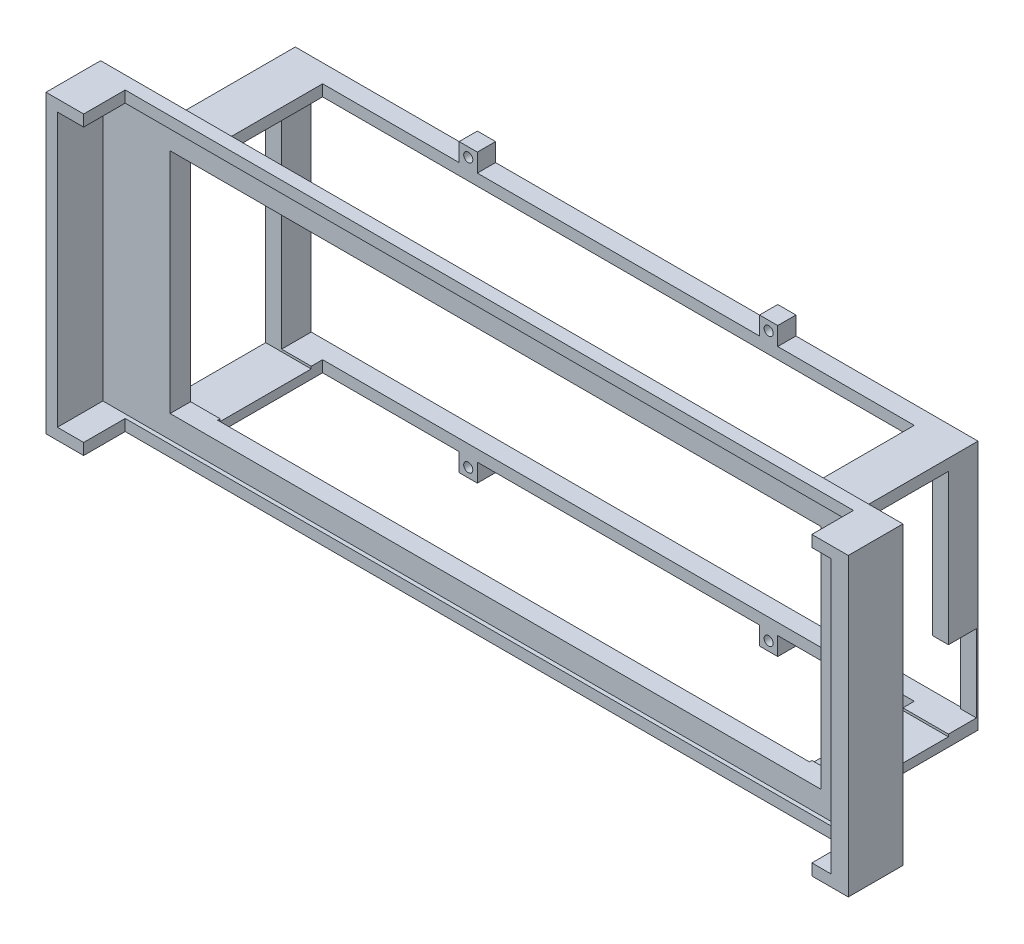
from build123d import *

# Parameters (mm, degrees)
SKETCH1_W               = 150
SKETCH1_H               = 55
SKETCH1_W_2             = 143
SKETCH1_H_2             = 50
BOSS_EXTRUDE1_DEPTH     = 30
CUT_EXTRUDE6_DEPTH      = 46
CUT_EXTRUDE6_DEPTH_BACK = 1
SKETCH2_W               = 170
SKETCH2_H               = 60
SKETCH3_W               = 176.272583165
SKETCH3_H               = 65
BOSS_EXTRUDE3_DEPTH     = 12
SKETCH4_W               = 170
SKETCH4_H               = 60
CUT_EXTRUDE7_DEPTH      = 10
CUT_EXTRUDE8_DEPTH      = 102.484371807
CUT_EXTRUDE8_DEPTH_BACK = 102.484371807
SKETCH5_W               = 143
SKETCH5_H               = 50
SKETCH6_W               = 4
SKETCH6_H               = 4
BOSS_EXTRUDE5_DEPTH     = 4
CUT_EXTRUDE9_DEPTH      = 105.971794883
CUT_EXTRUDE9_DEPTH_BACK = 4
SKETCH7_R               = 1
SKETCH8_W               = 28
SKETCH8_H               = 17
CUT_EXTRUDE12_DEPTH     = 10
SKETCH9_W               = 130
SKETCH9_H               = 23.050427834
CUT_EXTRUDE13_DEPTH     = 72
SKETCH10_W              = 20
SKETCH10_H              = 50.513415504
CUT_EXTRUDE14_DEPTH     = 177
SKETCH11_W              = 160
SKETCH11_H              = 10.657938717
CUT_EXTRUDE15_DEPTH     = 177


with BuildPart() as part:
    # Sketch1 → Boss-Extrude1 (new body)
    with BuildSketch(Plane.XY):
        with Locations((1.175180371, 5.902996071)):
            Rectangle(SKETCH1_W, SKETCH1_H)
        with Locations((1.175180371, 5.902996071)):
            Rectangle(SKETCH1_W_2, SKETCH1_H_2, mode=Mode.SUBTRACT)
    extrude(amount=BOSS_EXTRUDE1_DEPTH)

    # Sketch2 → Cut-Extrude6 (cut, two sides: drawn at the far end of the back side and taken through both)
    with BuildSketch(Plane.XY.offset(30).offset(-CUT_EXTRUDE6_DEPTH_BACK)):
        with Locations((1.175180371, 5.902996071)):
            Rectangle(SKETCH2_W, SKETCH2_H)
    extrude(amount=CUT_EXTRUDE6_DEPTH + CUT_EXTRUDE6_DEPTH_BACK, mode=Mode.SUBTRACT)

    # Sketch3 → Boss-Extrude3 (add)
    with BuildSketch(Plane.XY.offset(29)):
        with Locations((0.538888789, 5.902996071)):
            Rectangle(SKETCH3_W, SKETCH3_H)
    extrude(amount=BOSS_EXTRUDE3_DEPTH)

    # Sketch4 → Cut-Extrude7 (cut)
    with BuildSketch(Plane.XY.offset(41)):
        with Locations((-0.097402794, 5.902996071)):
            Rectangle(SKETCH4_W, SKETCH4_H)
    extrude(amount=-CUT_EXTRUDE7_DEPTH, mode=Mode.SUBTRACT)

    # Sketch5 → Cut-Extrude8 (cut, two sides: drawn at the far end of the back side and taken through both)
    with BuildSketch(Plane.XY.offset(31).offset(-CUT_EXTRUDE8_DEPTH_BACK)):
        with Locations((1.175180371, 5.902996071)):
            Rectangle(SKETCH5_W, SKETCH5_H)
    extrude(amount=CUT_EXTRUDE8_DEPTH + CUT_EXTRUDE8_DEPTH_BACK, mode=Mode.SUBTRACT)

    # Sketch6 → Boss-Extrude5 (add)
    with BuildSketch(Plane(origin=(0, 0, 0), x_dir=(-1, 0, 0), z_dir=(0, 0, -1))):
        with Locations((-34.175180371, -23.597003929)):
            Rectangle(SKETCH6_W, SKETCH6_H)
        with Locations((31.824819629, -23.597003929)):
            Rectangle(SKETCH6_W, SKETCH6_H)
        with Locations((-34.175180371, 35.402996071)):
            Rectangle(SKETCH6_W, SKETCH6_H)
        with Locations((31.824819629, 35.402996071)):
            Rectangle(SKETCH6_W, SKETCH6_H)
    extrude(amount=-BOSS_EXTRUDE5_DEPTH)

    # Sketch7 → Cut-Extrude9 (cut, two sides: drawn at the far end of the back side and taken through both)
    with BuildSketch(Plane(origin=(0, 0, 0), x_dir=(-1, 0, 0), z_dir=(0, 0, -1)).offset(-CUT_EXTRUDE9_DEPTH_BACK)):
        with Locations(Location((-34.175180371, 35.402996071, 0), (0, 0, 180))):
            Circle(SKETCH7_R)
        with Locations(Location((31.824819629, 35.402996071, 0), (0, 0, 180))):
            Circle(SKETCH7_R)
        with Locations(Location((31.824819629, -23.597003929, 0), (0, 0, 180))):
            Circle(SKETCH7_R)
        with Locations(Location((-34.175180371, -23.597003929, 0), (0, 0, 180))):
            Circle(SKETCH7_R)
    extrude(amount=CUT_EXTRUDE9_DEPTH + CUT_EXTRUDE9_DEPTH_BACK, mode=Mode.SUBTRACT)

    # Sketch8 → Cut-Extrude12 (cut)
    with BuildSketch(Plane(origin=(76.175180371, 0, 0), x_dir=(0, 0, -1), z_dir=(1, 0, 0))):
        with Locations((-14.356573147, -10.597003929)):
            Rectangle(SKETCH8_W, SKETCH8_H)
    extrude(amount=-CUT_EXTRUDE12_DEPTH, mode=Mode.SUBTRACT)

    # Sketch9 → Cut-Extrude13 (cut)
    with BuildSketch(Plane(origin=(0, 33.402996071, 0), x_dir=(1, 0, 0), z_dir=(0, 1, 0))):
        with Locations((1.175180371, -15.525213917)):
            Rectangle(SKETCH9_W, SKETCH9_H)
    extrude(amount=-CUT_EXTRUDE13_DEPTH, mode=Mode.SUBTRACT)

    # Sketch10 → Cut-Extrude14 (cut)
    with BuildSketch(Plane.ZY.offset(73.824819629)):
        with Locations((16.5, 5.646288319)):
            Rectangle(SKETCH10_W, SKETCH10_H)
    extrude(amount=-CUT_EXTRUDE14_DEPTH, mode=Mode.SUBTRACT)

    # Sketch11 → Cut-Extrude15 (cut)
    with BuildSketch(Plane(origin=(0, 38.402996071, 0), x_dir=(1, 0, 0), z_dir=(0, 1, 0))):
        with Locations((0.675180371, -37.197220061)):
            Rectangle(SKETCH11_W, SKETCH11_H)
    extrude(amount=-CUT_EXTRUDE15_DEPTH, mode=Mode.SUBTRACT)


solid = part.part
